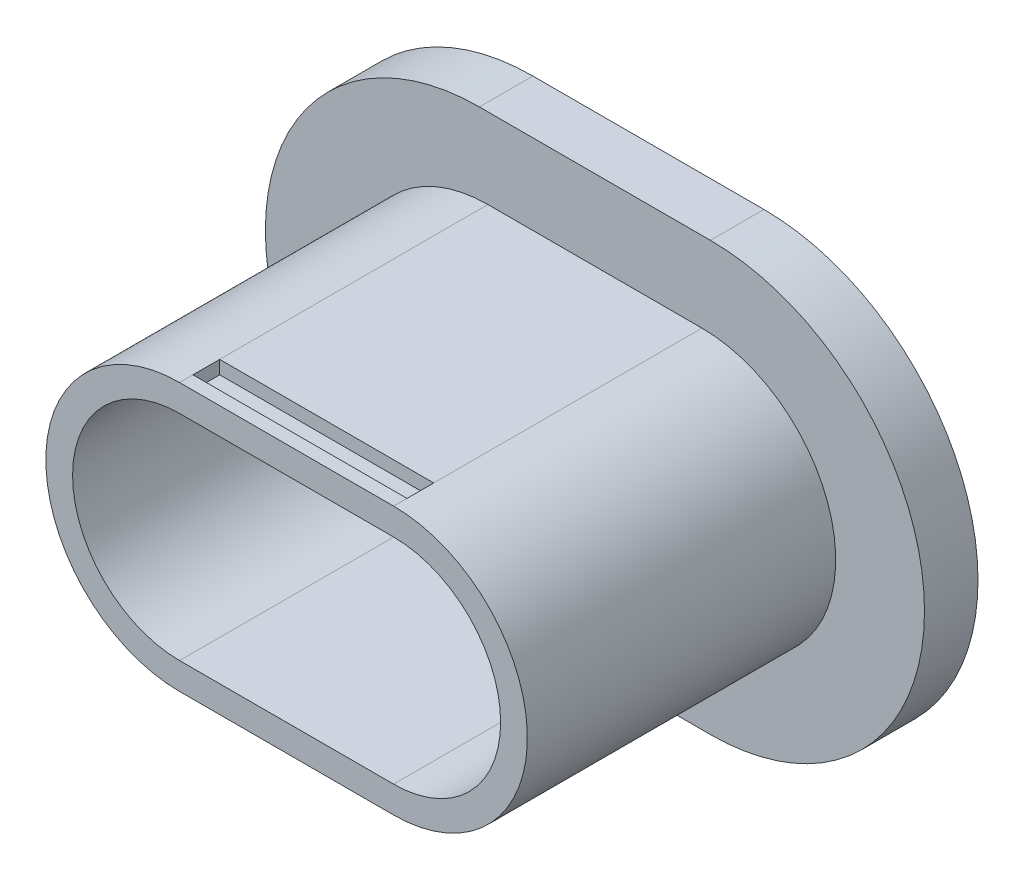
from build123d import *

# Parameters (mm, degrees)
BASEBOSS_EXTRUDE1_DEPTH = 2
BOSS_EXTRUDE2_DEPTH     = 11.525
SKETCH3_W               = 8
SKETCH3_H               = 1
CUT_EXTRUDE1_DEPTH      = 0.5
SKETCH4_W               = 8
SKETCH4_H               = 1
CUT_EXTRUDE2_DEPTH      = 0.5


with BuildPart() as part:
    # Sketch1 → BaseBoss-Extrude1 (new body)
    with BuildSketch(Plane.XY):
        with BuildLine():
            Line((19.925716198, 10.915607247), (28.562658873, 10.915607247))
            ThreePointArc((28.562658873, 10.915607247), (36.562658873, 2.915607247), (28.562658873, -5.084392753))
            Line((28.562658873, -5.084392753), (19.925716198, -5.084392753))
            ThreePointArc((19.925716198, -5.084392753), (11.925716198, 2.915607247), (19.925716198, 10.915607247))
        make_face()
        with BuildLine():
            Line((20.244187536, 6.915607247), (28.244187536, 6.915607247))
            ThreePointArc((28.244187536, 6.915607247), (32.244187536, 2.915607247), (28.244187536, -1.084392753))
            Line((28.244187536, -1.084392753), (20.244187536, -1.084392753))
            ThreePointArc((20.244187536, -1.084392753), (16.244187536, 2.915607247), (20.244187536, 6.915607247))
        make_face(mode=Mode.SUBTRACT)
    extrude(amount=BASEBOSS_EXTRUDE1_DEPTH)


with BuildPart() as body_2:
    # Sketch2 → Boss-Extrude2 (new body)
    with BuildSketch(Plane.XY.offset(2)):
        with BuildLine():
            Line((20.244187536, 7.915607247), (28.244187536, 7.915607247))
            ThreePointArc((28.244187536, 7.915607247), (33.244187536, 2.915607247), (28.244187536, -2.084392753))
            Line((28.244187536, -2.084392753), (20.244187536, -2.084392753))
            ThreePointArc((20.244187536, -2.084392753), (15.244187536, 2.915607247), (20.244187536, 7.915607247))
        make_face()
        with BuildLine():
            Line((20.244187536, 6.915607247), (28.244187536, 6.915607247))
            ThreePointArc((28.244187536, 6.915607247), (32.244187536, 2.915607247), (28.244187536, -1.084392753))
            Line((28.244187536, -1.084392753), (20.244187536, -1.084392753))
            ThreePointArc((20.244187536, -1.084392753), (16.244187536, 2.915607247), (20.244187536, 6.915607247))
        make_face(mode=Mode.SUBTRACT)
    extrude(amount=BOSS_EXTRUDE2_DEPTH)

    # Sketch3 → Cut-Extrude1 (cut)
    with BuildSketch(Plane.XZ.offset(2.084392753)):
        with Locations((24.244187536, 12.525)):
            Rectangle(SKETCH3_W, SKETCH3_H)
    extrude(amount=-CUT_EXTRUDE1_DEPTH, mode=Mode.SUBTRACT)

    # Sketch4 → Cut-Extrude2 (cut)
    with BuildSketch(Plane(origin=(0, 7.915607247, 0), x_dir=(1, 0, 0), z_dir=(0, 1, 0))):
        with Locations((24.244187536, -12.525)):
            Rectangle(SKETCH4_W, SKETCH4_H)
    extrude(amount=-CUT_EXTRUDE2_DEPTH, mode=Mode.SUBTRACT)


solid = Compound([part.part, body_2.part])
